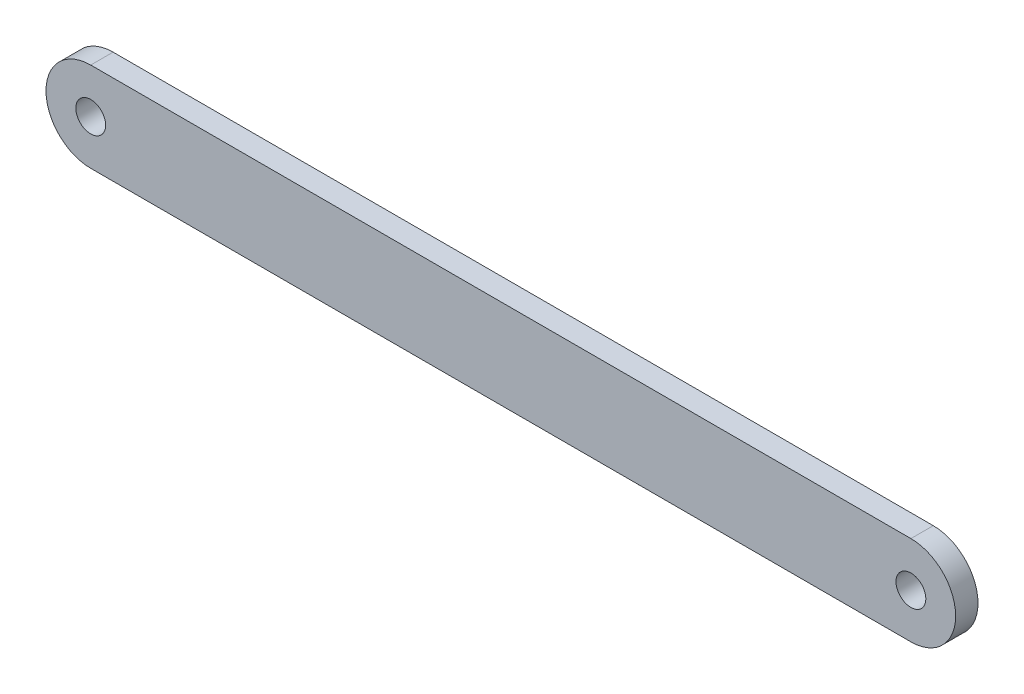
from build123d import *

# Parameters (mm, degrees)
SKETCH1_R           = 2
BOSS_EXTRUDE3_DEPTH = 3


with BuildPart() as part:
    # Sketch1 → Boss-Extrude3 (new body)
    with BuildSketch(Plane.XY):
        with BuildLine():
            Line((-35.312724167, 6), (74.687275833, 6))
            ThreePointArc((74.687275833, 6), (80.687275833, 0), (74.687275833, -6))
            Line((74.687275833, -6), (-35.312724167, -6))
            ThreePointArc((-35.312724167, -6), (-41.312724167, 0), (-35.312724167, 6))
        make_face()
        with Locations((-35.312724167, 0)):
            Circle(SKETCH1_R, mode=Mode.SUBTRACT)
        with Locations((74.687275833, 0)):
            Circle(SKETCH1_R, mode=Mode.SUBTRACT)
    extrude(amount=BOSS_EXTRUDE3_DEPTH)


solid = part.part
